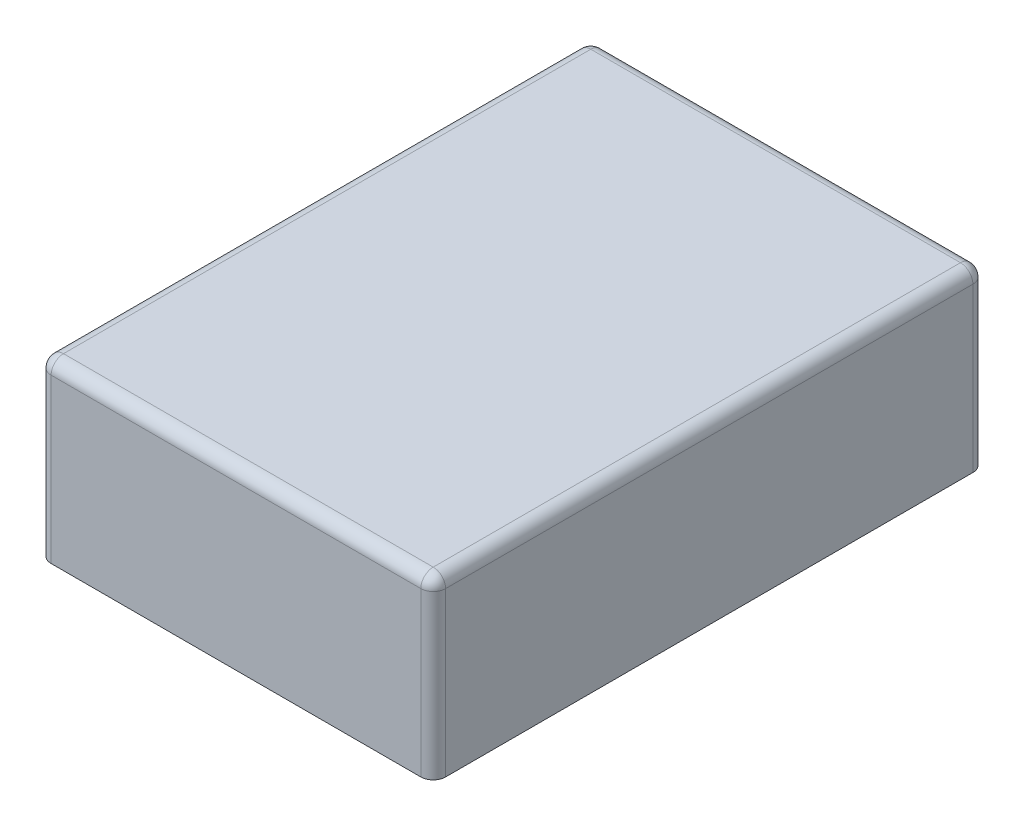
from build123d import *

# Parameters (mm, degrees)
SKETCH1_W           = 95.4
SKETCH1_H           = 133.5
SKETCH1_W_2         = 89.4
SKETCH1_H_2         = 127.5
EXTRUDE_THIN1_DEPTH = 37.45
SKETCH2_W           = 95.4
SKETCH2_H           = 133.5
BOSS_EXTRUDE1_DEPTH = 5
FILLET3_R           = 3
FILLET4_R           = 3


with BuildPart() as part:
    # Sketch1 → Extrude-Thin1 (new body)
    with BuildSketch(Plane(origin=(0, 0, 0), x_dir=(1, 0, 0), z_dir=(0, 1, 0))):
        with Locations((-0.544500843, -0.326636011)):
            Rectangle(SKETCH1_W, SKETCH1_H)
        with Locations((-0.544500843, -0.326636011)):
            Rectangle(SKETCH1_W_2, SKETCH1_H_2, mode=Mode.SUBTRACT)
    extrude(amount=EXTRUDE_THIN1_DEPTH)

    # Sketch2 → Boss-Extrude1 (add)
    with BuildSketch(Plane(origin=(0, 37.45, 0), x_dir=(1, 0, 0), z_dir=(0, 1, 0))):
        with Locations((-0.544500843, -0.326636011)):
            Rectangle(SKETCH2_W, SKETCH2_H)
    extrude(amount=BOSS_EXTRUDE1_DEPTH)

    # Fillet3
    fillet3_edges = [part.edges().sort_by_distance(p)[0] for p in [
        (47.155499157, 21.225, 67.076636011),
        (-48.244500843, 21.225, 67.076636011),
        (-48.244500843, 21.225, -66.423363989),
        (47.155499157, 21.225, -66.423363989),
    ]]
    fillet(fillet3_edges, radius=FILLET3_R)

    # Fillet4
    fillet4_edges = [part.edges().sort_by_distance(p)[0] for p in [
        (-0.544500843, 42.45, 67.076636011),
        (-48.244500843, 42.45, 0.326636011),
        (47.155499157, 42.45, 0.326636011),
        (-0.544500843, 42.45, -66.423363989),
        (-47.365821187, 42.45, -65.544684332),
        (46.2768195, 42.45, -65.544684332),
        (46.2768195, 42.45, 66.197956355),
        (-47.365821187, 42.45, 66.197956355),
    ]]
    fillet(fillet4_edges, radius=FILLET4_R)


solid = part.part
